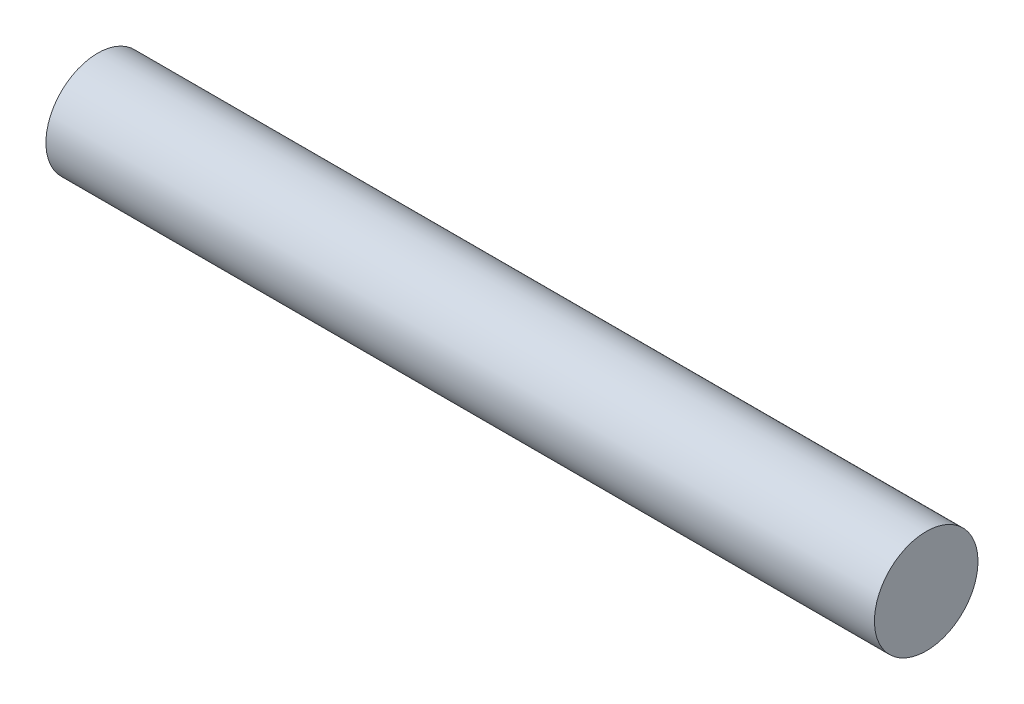
from build123d import *

# Parameters (mm, degrees)
CROQUIS1_R              = 1
SALIENTE_EXTRUIR1_DEPTH = 8


with BuildPart() as part:
    # Croquis1 → Saliente-Extruir1 (new, symmetric)
    with BuildSketch(Plane(origin=(0, 0, 0), x_dir=(0, 0, -1), z_dir=(1, 0, 0))):
        Circle(CROQUIS1_R)
    extrude(amount=SALIENTE_EXTRUIR1_DEPTH, both=True)


solid = part.part
